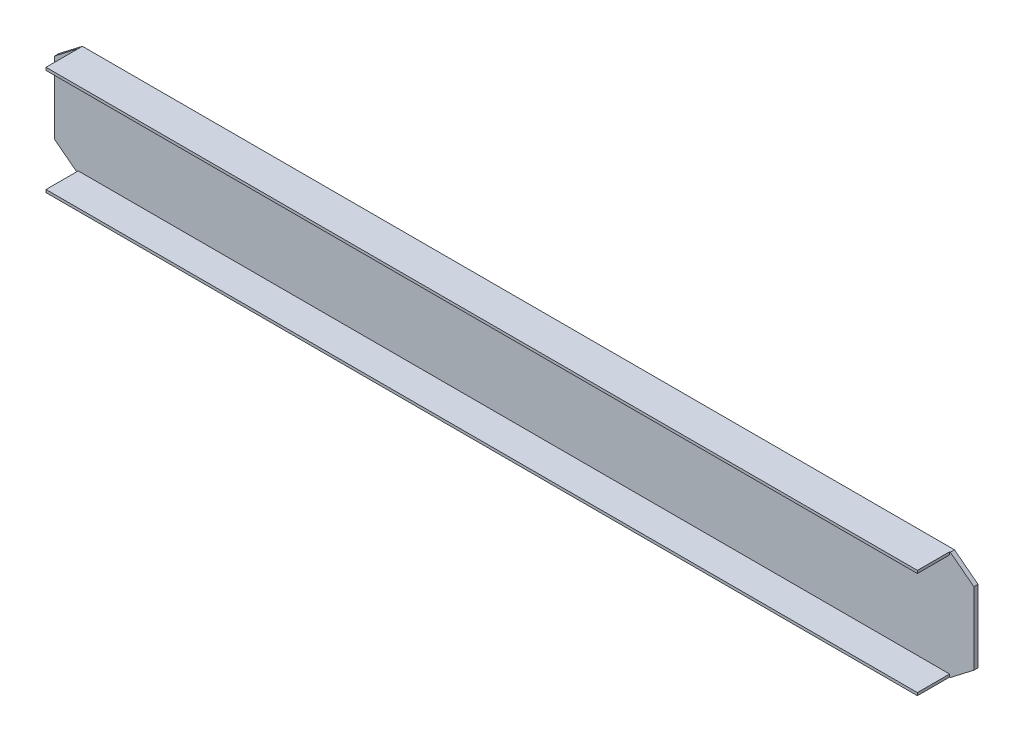
from build123d import *

# Parameters (mm, degrees)
SKETCH_1_R          = 13
EXTRUDE_802_DEPTH   = 11.5
SKETCH_2_W          = 2408.049034164
SKETCH_2_H          = 7.5
EXTRUDE_1_DEPTH     = 89
SKETCH_3_W          = 80
SKETCH_3_H          = 240
EXTRUDE_2_DEPTH     = 16
SKETCH_4_R          = 13
CUT_EXTRUDE_1_DEPTH = 1308.983562588
EXTRUDE_3_DEPTH     = 11.5
SKETCH_6_W          = 80
SKETCH_6_H          = 240
EXTRUDE_4_DEPTH     = 16


with BuildPart() as part:
    # 草图1 → Extrude 802 (new body)
    with BuildSketch(Plane.XY):
        Polygon((-1205, 0), (1205, 0), (1270, 50), (1270, 250), (1205, 300), (-1205, 300), (-1270, 250), (-1270, 50), align=None)
        with Locations((-1220, 230)):
            Circle(SKETCH_1_R, mode=Mode.SUBTRACT)
        with Locations((-1220, 150)):
            Circle(SKETCH_1_R, mode=Mode.SUBTRACT)
        with Locations((-1140, 230)):
            Circle(SKETCH_1_R, mode=Mode.SUBTRACT)
        with Locations((-1140, 150)):
            Circle(SKETCH_1_R, mode=Mode.SUBTRACT)
        with Locations((-1060, 230)):
            Circle(SKETCH_1_R, mode=Mode.SUBTRACT)
        with Locations((-1060, 150)):
            Circle(SKETCH_1_R, mode=Mode.SUBTRACT)
        with Locations((-980, 150)):
            Circle(SKETCH_1_R, mode=Mode.SUBTRACT)
        with Locations(Location((-1060, 70, 0), (0, 0, 180))):
            Circle(SKETCH_1_R, mode=Mode.SUBTRACT)
        with Locations(Location((-1140, 70, 0), (0, 0, 180))):
            Circle(SKETCH_1_R, mode=Mode.SUBTRACT)
        with Locations(Location((-1220, 70, 0), (0, 0, 180))):
            Circle(SKETCH_1_R, mode=Mode.SUBTRACT)
        with Locations((1220, 70)):
            Circle(SKETCH_1_R, mode=Mode.SUBTRACT)
        with Locations((1140, 70)):
            Circle(SKETCH_1_R, mode=Mode.SUBTRACT)
        with Locations((1060, 70)):
            Circle(SKETCH_1_R, mode=Mode.SUBTRACT)
        with Locations(Location((980, 150, 0), (0, 0, 180))):
            Circle(SKETCH_1_R, mode=Mode.SUBTRACT)
        with Locations(Location((1060, 150, 0), (0, 0, 180))):
            Circle(SKETCH_1_R, mode=Mode.SUBTRACT)
        with Locations(Location((1060, 230, 0), (0, 0, 180))):
            Circle(SKETCH_1_R, mode=Mode.SUBTRACT)
        with Locations(Location((1140, 150, 0), (0, 0, 180))):
            Circle(SKETCH_1_R, mode=Mode.SUBTRACT)
        with Locations(Location((1140, 230, 0), (0, 0, 180))):
            Circle(SKETCH_1_R, mode=Mode.SUBTRACT)
        with Locations(Location((1220, 150, 0), (0, 0, 180))):
            Circle(SKETCH_1_R, mode=Mode.SUBTRACT)
        with Locations(Location((1220, 230, 0), (0, 0, 180))):
            Circle(SKETCH_1_R, mode=Mode.SUBTRACT)
        with Locations((-980, 70)):
            Circle(SKETCH_1_R, mode=Mode.SUBTRACT)
        with Locations((-980, 230)):
            Circle(SKETCH_1_R, mode=Mode.SUBTRACT)
        with Locations((980, 70)):
            Circle(SKETCH_1_R, mode=Mode.SUBTRACT)
        with Locations((980, 230)):
            Circle(SKETCH_1_R, mode=Mode.SUBTRACT)
    extrude(amount=-EXTRUDE_802_DEPTH)

    # 草图2 → 凸台-拉伸1 (add)
    with BuildSketch(Plane.XY):
        with Locations((-0.975482918, 296.25)):
            Rectangle(SKETCH_2_W, SKETCH_2_H)
        with Locations((-0.975482918, 3.75)):
            Rectangle(SKETCH_2_W, SKETCH_2_H)
    extrude(amount=EXTRUDE_1_DEPTH)

    # 草图3 → 凸台-拉伸2 (add)
    with BuildSketch(Plane(origin=(0, 0, -11.5), x_dir=(-1, 0, 0), z_dir=(0, 0, -1))):
        with Locations((-580, 150)):
            Rectangle(SKETCH_3_W, SKETCH_3_H)
        with Locations((-180, 150)):
            Rectangle(SKETCH_3_W, SKETCH_3_H)
        with Locations((180, 150)):
            Rectangle(SKETCH_3_W, SKETCH_3_H)
        with Locations((580, 150)):
            Rectangle(SKETCH_3_W, SKETCH_3_H)
    extrude(amount=EXTRUDE_2_DEPTH)

    # 草图4 → 切除-拉伸1 (cut, through all)
    with BuildSketch(Plane.XY):
        with Locations((-580, 230)):
            Circle(SKETCH_4_R)
        with Locations((-580, 150)):
            Circle(SKETCH_4_R)
        with Locations((-180, 230)):
            Circle(SKETCH_4_R)
        with Locations((-180, 150)):
            Circle(SKETCH_4_R)
        with Locations(Location((-180, 70, 0), (0, 0, 180))):
            Circle(SKETCH_4_R)
        with Locations(Location((-580, 70, 0), (0, 0, 180))):
            Circle(SKETCH_4_R)
        with Locations((580, 70)):
            Circle(SKETCH_4_R)
        with Locations((180, 70)):
            Circle(SKETCH_4_R)
        with Locations(Location((180, 150, 0), (0, 0, 180))):
            Circle(SKETCH_4_R)
        with Locations(Location((180, 230, 0), (0, 0, 180))):
            Circle(SKETCH_4_R)
        with Locations(Location((580, 150, 0), (0, 0, 180))):
            Circle(SKETCH_4_R)
        with Locations(Location((580, 230, 0), (0, 0, 180))):
            Circle(SKETCH_4_R)
    extrude(amount=-CUT_EXTRUDE_1_DEPTH, mode=Mode.SUBTRACT)

    # 草图5 → 凸台-拉伸3 (add)
    with BuildSketch(Plane.XY):
        Polygon((-1270, 250), (-1270, 50), (-1205, 0), (1205, 0), (1270, 50), (1270, 250), (1205, 300), (-1205, 300), align=None)
    extrude(amount=-EXTRUDE_3_DEPTH)

    # 草图6 → 凸台-拉伸4 (add)
    with BuildSketch(Plane(origin=(0, 0, -11.5), x_dir=(-1, 0, 0), z_dir=(0, 0, -1))):
        with Locations((-580, 150)):
            Rectangle(SKETCH_6_W, SKETCH_6_H)
        with Locations((-180, 150)):
            Rectangle(SKETCH_6_W, SKETCH_6_H)
        with Locations((180, 150)):
            Rectangle(SKETCH_6_W, SKETCH_6_H)
        with Locations((580, 150)):
            Rectangle(SKETCH_6_W, SKETCH_6_H)
    extrude(amount=EXTRUDE_4_DEPTH)


solid = part.part
